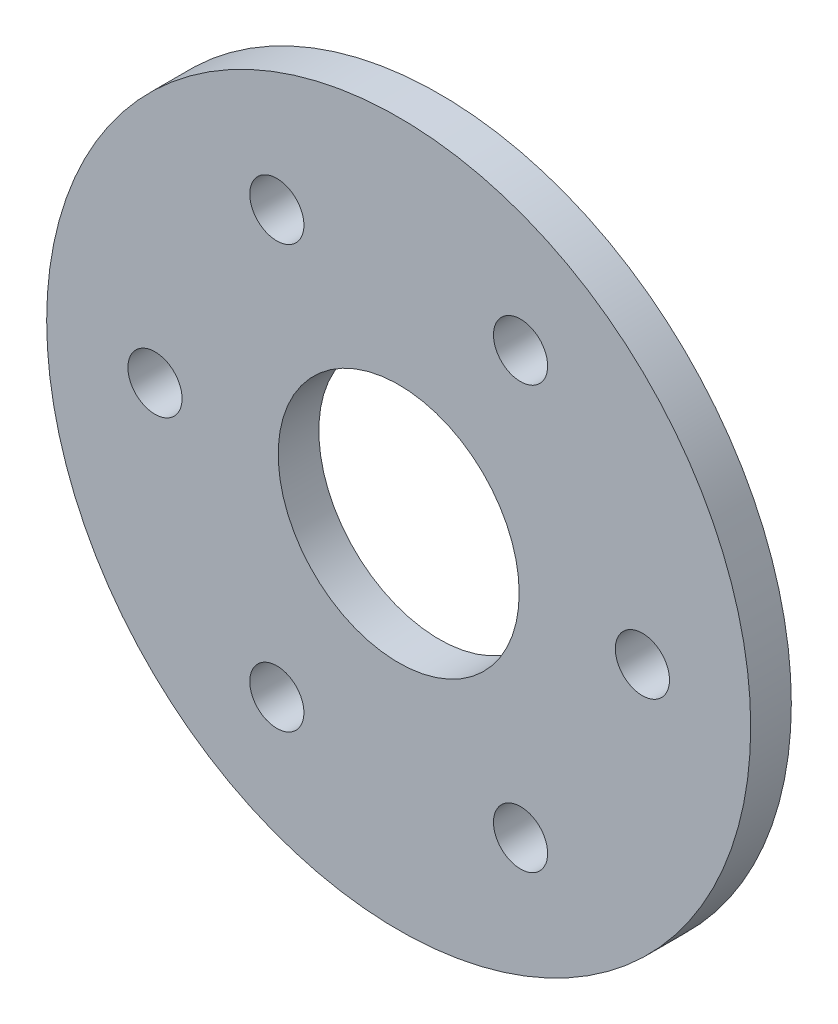
from build123d import *

# Parameters (mm, degrees)
CROQUIS1_R              = 26
CROQUIS1_R_2            = 2
CROQUIS1_R_3            = 8.9
SALIENTE_EXTRUIR1_DEPTH = 3


with BuildPart() as part:
    # Croquis1 → Saliente-Extruir1 (new body)
    with BuildSketch(Plane.XY):
        Circle(CROQUIS1_R)
        with Locations((-18, 0)):
            Circle(CROQUIS1_R_2, mode=Mode.SUBTRACT)
        with Locations((-9, 15.588457268)):
            Circle(CROQUIS1_R_2, mode=Mode.SUBTRACT)
        with Locations((9, 15.588457268)):
            Circle(CROQUIS1_R_2, mode=Mode.SUBTRACT)
        with Locations((18, 0)):
            Circle(CROQUIS1_R_2, mode=Mode.SUBTRACT)
        with Locations((9, -15.588457268)):
            Circle(CROQUIS1_R_2, mode=Mode.SUBTRACT)
        with Locations((-9, -15.588457268)):
            Circle(CROQUIS1_R_2, mode=Mode.SUBTRACT)
        Circle(CROQUIS1_R_3, mode=Mode.SUBTRACT)
    extrude(amount=SALIENTE_EXTRUIR1_DEPTH)


solid = part.part
